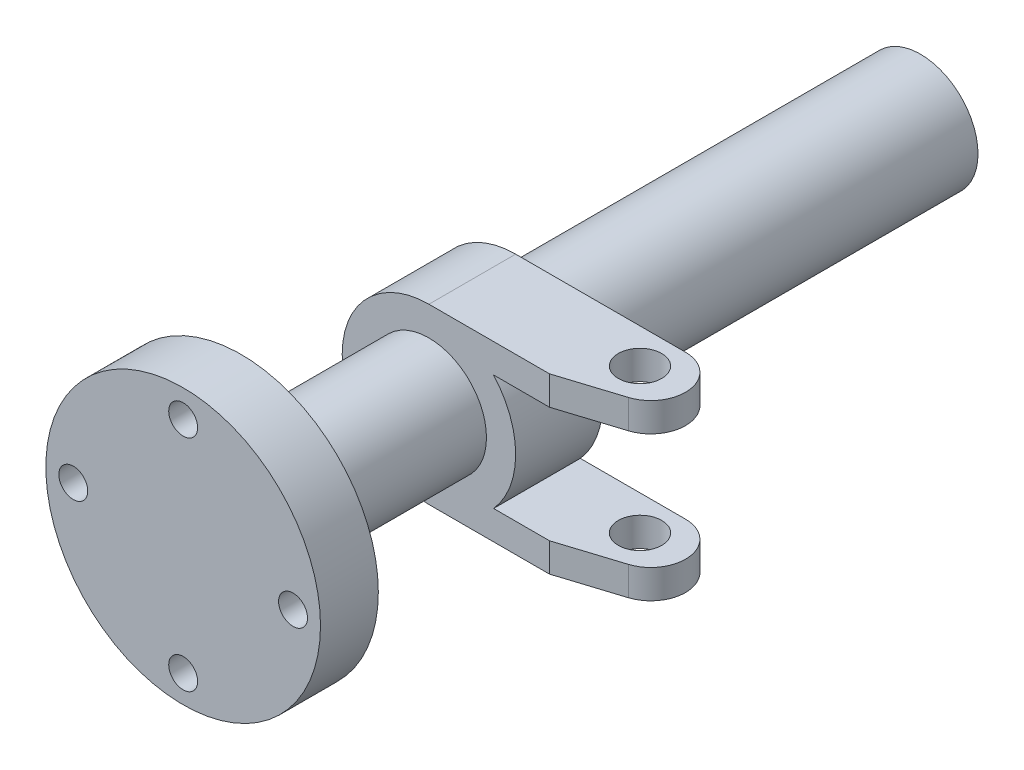
from build123d import *

# Parameters (mm, degrees)
SKETCH2_R                               = 7.5
BOSS_EXTRUDE1_DEPTH                     = 10
CBORE_FOR_M5_HEX_HEAD_BOLT1_D           = 10
CBORE_FOR_M5_HEX_HEAD_BOLT1_CBORE_D     = 14
CBORE_FOR_M5_HEX_HEAD_BOLT1_CBORE_DEPTH = 10
CIRPATTERN1_COUNT                       = 4


with BuildPart() as part:
    # Sketch1 → Revolve1 (revolve)
    with BuildSketch(Plane(origin=(0, 0, 0), x_dir=(1, 0, 0), z_dir=(0, 1, 0))):
        Polygon((0, 255), (19.9, 255), (19.9, 115), (30, 115), (30, 85), (19.9, 85), (19.9, 20), (47.5, 20), (47.5, 0), (0, 0), align=None)
    revolve(axis=Axis((0, 0, 0), (0, 0, -1)))

    # Sketch2 → Boss-Extrude1 (add)
    with BuildSketch(Plane(origin=(0, 30, 0), x_dir=(1, 0, 0), z_dir=(0, 1, 0))):
        with BuildLine():
            Line((0, 115), (58.75, 115))
            ThreePointArc((58.75, 115), (70.608856816, 104.835079022), (62.376989895, 91.561252503))
            Line((62.376989895, 91.561252503), (60, 90.807558243))
            Line((60, 90.807558243), (41.684208051, 85))
            Line((41.684208051, 85), (30, 85))
            Line((30, 85), (0, 85))
            Line((0, 85), (0, 115))
        make_face()
        with Locations(Location((55, 103, 0), (0, 0, 270))):
            Circle(SKETCH2_R, mode=Mode.SUBTRACT)
    boss_extrude1 = extrude(amount=-BOSS_EXTRUDE1_DEPTH)

    # Mirror1: Boss-Extrude1 across plane
    add(boss_extrude1.mirror(Plane.ZX))

    # CBORE for M5 Hex Head Bolt1 (through all)
    with Locations(Plane(origin=(0, 0, -20), x_dir=(-1, 0, 0), z_dir=(0, 0, -1))):
        with Locations((0, 38)):
            cbore_for_m5_hex_head_bolt1 = CounterBoreHole(CBORE_FOR_M5_HEX_HEAD_BOLT1_D / 2, CBORE_FOR_M5_HEX_HEAD_BOLT1_CBORE_D / 2, CBORE_FOR_M5_HEX_HEAD_BOLT1_CBORE_DEPTH)

    # CirPattern1: CBORE for M5 Hex Head Bolt1 ×4 about axis
    cirpattern1_axis = Axis((0, 0, 0), (0, 0, 1))
    for i in range(1, CIRPATTERN1_COUNT):
        add(cbore_for_m5_hex_head_bolt1.rotate(cirpattern1_axis, i * 360 / CIRPATTERN1_COUNT), mode=Mode.SUBTRACT)


solid = part.part
